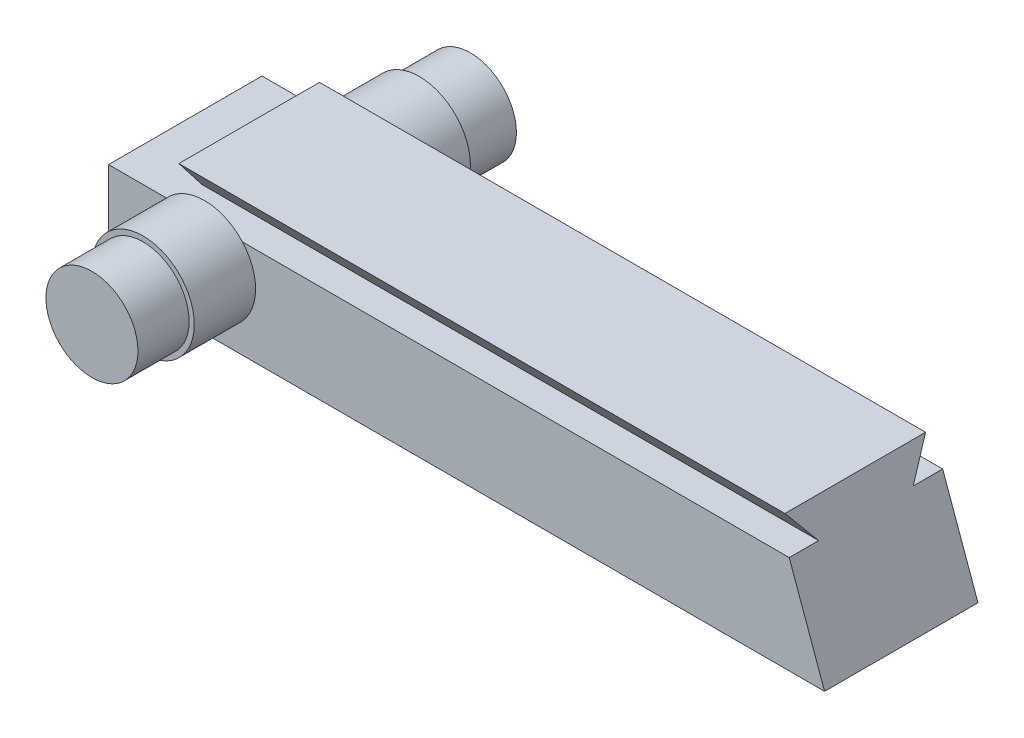
from build123d import *

# Parameters (mm, degrees)
SKETCH1_W           = 7.62
SKETCH1_H           = 4.8768
BOSS_EXTRUDE1_DEPTH = 17.78
BOSS_EXTRUDE2_DEPTH = 32.385
CUT_EXTRUDE1_DEPTH  = 20.735587515
SKETCH5_R           = 2.54
BOSS_EXTRUDE3_DEPTH = 3.048
SKETCH7_R           = 2.286
BOSS_EXTRUDE4_DEPTH = 2.54


with BuildPart() as part:
    # Sketch1 → Boss-Extrude1 (new, symmetric)
    with BuildSketch(Plane(origin=(0, 0, 0), x_dir=(0, 0, -1), z_dir=(1, 0, 0))):
        Rectangle(SKETCH1_W, SKETCH1_H)
    extrude(amount=BOSS_EXTRUDE1_DEPTH, both=True)

    # Sketch2 → Boss-Extrude2 (add)
    with BuildSketch(Plane(origin=(17.78, 0, 0), x_dir=(0, 0, -1), z_dir=(1, 0, 0))):
        Polygon((-3.4925, 3.9116), (3.4925, 3.9116), (2.3495, 2.4384), (-2.3495, 2.4384), align=None)
    extrude(amount=-BOSS_EXTRUDE2_DEPTH)

    # Sketch3 → Cut-Extrude1 (cut, through all)
    with BuildSketch(Plane.XY.offset(3.81)):
        Polygon((17.78, -2.4384), (15.494, 3.9116), (17.78, 3.9116), align=None)
    extrude(amount=-CUT_EXTRUDE1_DEPTH, mode=Mode.SUBTRACT)

    # Sketch5 → Boss-Extrude3 (add)
    with BuildSketch(Plane.XY.offset(3.81)):
        with Locations(Location((-13.0175, 0.7366, 0), (0, 0, 137.932935198))):
            Circle(SKETCH5_R)
    boss_extrude3 = extrude(amount=BOSS_EXTRUDE3_DEPTH)

    # Sketch7 → Boss-Extrude4 (add)
    with BuildSketch(Plane.XY.offset(6.858)):
        with Locations((-13.0175, 0.7366)):
            Circle(SKETCH7_R)
    boss_extrude4 = extrude(amount=BOSS_EXTRUDE4_DEPTH)

    # Mirror1: Boss-Extrude3, Boss-Extrude4 across plane
    add(boss_extrude3.mirror(Plane.XY))
    add(boss_extrude4.mirror(Plane.XY))


solid = part.part
